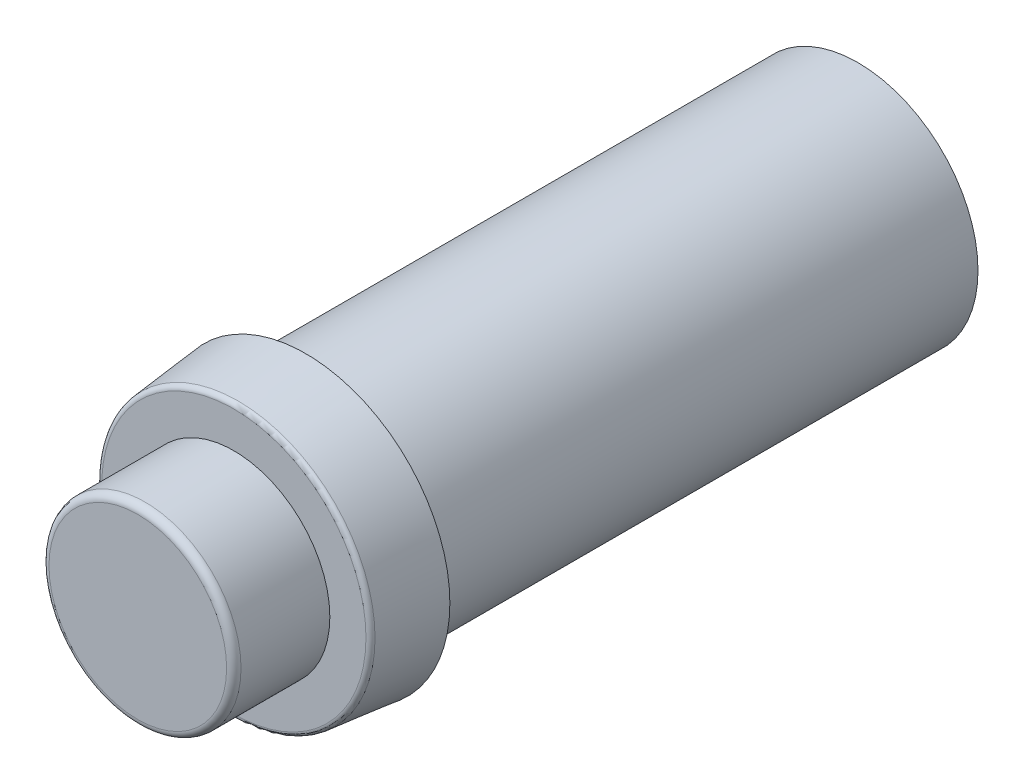
from build123d import *

# Parameters (mm, degrees)
ESBO_O1_R                = 5
RESSALTO_EXTRUS_O1_DEPTH = 23
ESBO_O2_R                = 6
RESSALTO_EXTRUS_O2_DEPTH = 3
RESSALTO_EXTRUS_O2_TAPER = 6
FILETE1_R                = 0.2
ESBO_O3_R                = 4
RESSALTO_EXTRUS_O3_DEPTH = 4
FILETE2_R                = 0.3


with BuildPart() as part:
    # Esboço1 → Ressalto-extrusão1 (new body)
    with BuildSketch(Plane.XY):
        Circle(ESBO_O1_R)
    extrude(amount=-RESSALTO_EXTRUS_O1_DEPTH)

    # Esboço2 → Ressalto-extrusão2 (add)
    with BuildSketch(Plane.XY):
        Circle(ESBO_O2_R)
    extrude(amount=RESSALTO_EXTRUS_O2_DEPTH, taper=RESSALTO_EXTRUS_O2_TAPER)

    # Filete1
    filete1_edges = [part.edges().sort_by_distance(p)[0] for p in [
        (-5.684687294, 0, 3),
    ]]
    fillet(filete1_edges, radius=FILETE1_R)


with BuildPart() as body_2:
    # Esboço3 → Ressalto-extrusão3 (new body)
    with BuildSketch(Plane.XY.offset(3)):
        Circle(ESBO_O3_R)
    extrude(amount=RESSALTO_EXTRUS_O3_DEPTH)

    # Filete2
    filete2_edges = [body_2.edges().sort_by_distance(p)[0] for p in [
        (-4, 0, 7),
    ]]
    fillet(filete2_edges, radius=FILETE2_R)


solid = Compound([part.part, body_2.part])
